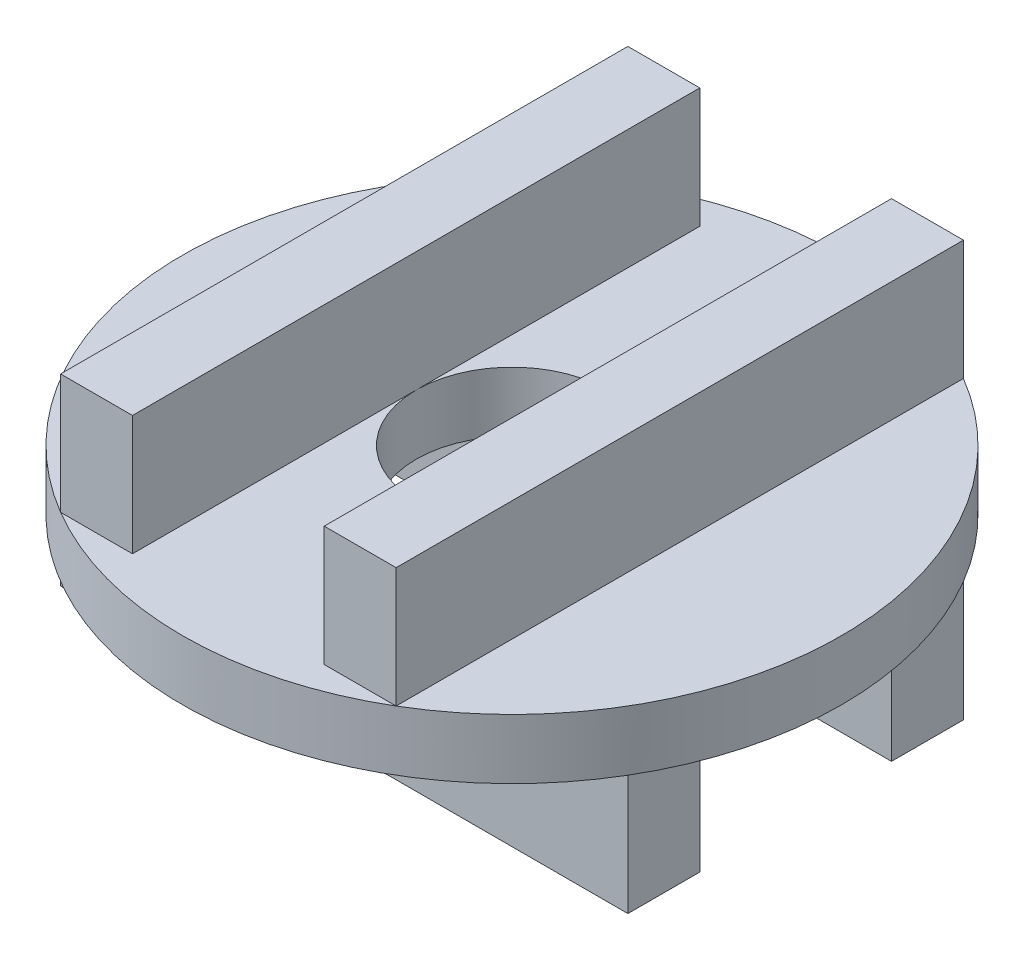
from build123d import *

# Parameters (mm, degrees)
SKETCH1_R           = 55
SKETCH1_R_2         = 16
BOSS_EXTRUDE1_DEPTH = 10
SKETCH2_W           = 12
SKETCH2_H           = 94.678403028
BOSS_EXTRUDE2_DEPTH = 20
SKETCH4_W           = 94.678403028
SKETCH4_H           = 12
BOSS_EXTRUDE3_DEPTH = 20


with BuildPart() as part:
    # Sketch1 → Boss-Extrude1 (new body)
    with BuildSketch(Plane(origin=(0, 0, 0), x_dir=(1, 0, 0), z_dir=(0, 1, 0))):
        with Locations(Location((0, 0, 0), (0, 0, 270))):
            Circle(SKETCH1_R)
        with Locations(Location((0, 0, 0), (0, 0, 270))):
            Circle(SKETCH1_R_2, mode=Mode.SUBTRACT)
    extrude(amount=BOSS_EXTRUDE1_DEPTH)

    # Sketch2 → Boss-Extrude2 (add)
    with BuildSketch(Plane(origin=(0, 10, 0), x_dir=(1, 0, 0), z_dir=(0, 1, 0))):
        with Locations((22, 0)):
            Rectangle(SKETCH2_W, SKETCH2_H)
        with Locations((-22, 0)):
            Rectangle(SKETCH2_W, SKETCH2_H)
    extrude(amount=BOSS_EXTRUDE2_DEPTH)

    # Sketch4 → Boss-Extrude3 (add)
    with BuildSketch(Plane.XZ):
        with Locations((0, 22)):
            Rectangle(SKETCH4_W, SKETCH4_H)
        with Locations((0, -22)):
            Rectangle(SKETCH4_W, SKETCH4_H)
    extrude(amount=BOSS_EXTRUDE3_DEPTH)


solid = part.part
